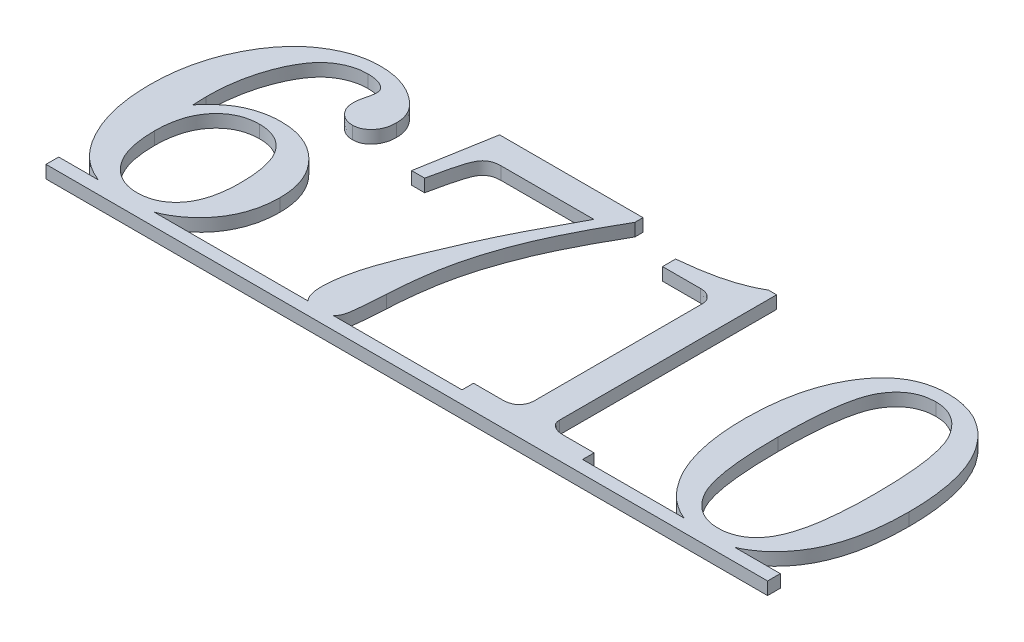
from build123d import *

# Parameters (mm, degrees)
BOSS_EXTRUDE2_DEPTH   = 5
BOSS_EXTRUDE2_2_DEPTH = 5
BOSS_EXTRUDE2_3_DEPTH = 5
BOSS_EXTRUDE2_4_DEPTH = 5
SKETCH6_W             = 283.8598671
SKETCH6_H             = 5
EXTRUDE_THIN9_DEPTH   = 5


with BuildPart() as part:
    # Sketch2 → Boss-Extrude2 (new body)
    with BuildSketch(Plane(origin=(0, 0, 0), x_dir=(1, 0, 0), z_dir=(0, 1, 0))):
        with BuildLine():
            add(Edge.make_bspline(
                [(-100.273944562, 11.315591843), (-99.432422661, 12.296005541), (-97.80531775, 14.191661424), (-95.124150317, 16.632446976), (-92.410660251, 18.678343856), (-89.586741579, 20.255885879), (-86.66536121, 21.455130526), (-83.616869513, 22.287043947), (-80.435400554, 22.837296348), (-78.261064732, 22.888267077), (-77.156957382, 22.914149536)],
                knots=[0, 0, 0, 0, 1.15518856, 2.233587714, 3.237434965, 4.189814948, 5.119660525, 6.056163246, 7.012937916, 8, 8, 8, 8], degree=3))
            add(Edge.make_bspline(
                [(-77.156957382, 22.914149536), (-76.267872032, 22.88979057), (-74.516489022, 22.841806561), (-71.94485009, 22.500634422), (-69.491077891, 21.915587863), (-67.145068853, 21.113058273), (-64.909427532, 20.063895456), (-62.784316633, 18.777349249), (-60.771731685, 17.266813831), (-58.897132382, 15.545958714), (-57.177159253, 13.655514974), (-55.676321774, 11.612805388), (-54.398324958, 9.446209735), (-53.357216887, 7.16351283), (-52.551214736, 4.75203121), (-51.970139378, 2.223901106), (-51.627369058, -0.433830019), (-51.580079845, -2.245110958), (-51.555995844, -3.167581233)],
                knots=[0, 0, 0, 0, 1.044483906, 2.057498042, 3.041291563, 4.003930521, 4.965577941, 5.937000168, 6.91766058, 7.91718785, 8.922517361, 9.915774843, 10.889917702, 11.872928882, 12.857847881, 13.872197807, 14.916328091, 16, 16, 16, 16], degree=3))
            add(Edge.make_bspline(
                [(-51.555995844, -3.167581233), (-51.581911796, -4.277388433), (-51.632844197, -6.458483113), (-52.064682487, -9.658046806), (-52.763484524, -12.717407155), (-53.741106198, -15.634942055), (-55.02601744, -18.395059066), (-56.537373496, -21.038920532), (-58.384625631, -23.508995506), (-60.471634529, -25.815031514), (-62.760543423, -27.906607194), (-65.202901, -29.742899087), (-67.76860182, -31.321824534), (-70.490062414, -32.580382215), (-73.334022253, -33.572853122), (-76.315128869, -34.268944993), (-79.427938671, -34.700620945), (-81.54923928, -34.752056727), (-82.625707382, -34.778158157)],
                knots=[0, 0, 0, 0, 1.07530773, 2.113293164, 3.12278084, 4.113357206, 5.089279015, 6.06946209, 7.059700115, 8.072336363, 9.080183726, 10.060046246, 11.030156511, 11.994333323, 12.960419743, 13.944696705, 14.957022674, 16, 16, 16, 16], degree=3))
            add(Edge.make_bspline(
                [(-82.625707382, -34.778158157), (-83.387383318, -34.761014278), (-84.900510493, -34.72695666), (-87.13781002, -34.508364454), (-89.314156186, -34.12631249), (-91.424542881, -33.585335042), (-93.464719495, -32.882045184), (-95.448070736, -32.034447532), (-97.360972645, -31.033369296), (-99.222768123, -29.893982317), (-100.983959191, -28.554896899), (-102.688465866, -27.08076911), (-104.308040499, -25.422683644), (-105.811585824, -23.5763933), (-107.27439168, -21.581836531), (-108.627629559, -19.402412836), (-109.880875821, -17.042765096), (-111.09498075, -14.549636194), (-112.161562949, -11.896159256), (-113.110296174, -9.131198402), (-113.889362692, -6.251771742), (-114.522912574, -3.260405275), (-115.050026571, -0.168271005), (-115.410142871, 3.035069393), (-115.603500406, 6.345226369), (-115.639998998, 8.590997895), (-115.658559947, 9.733059792)],
                knots=[0, 0, 0, 0, 0.883664919, 1.755467568, 2.604957291, 3.444820255, 4.280205446, 5.10616279, 5.944667041, 6.78306393, 7.635198672, 8.508239482, 9.395699299, 10.320121956, 11.268418048, 12.263647801, 13.293052967, 14.36716297, 15.479155568, 16.608498161, 17.756732724, 18.93730736, 20.154818251, 21.394408002, 22.674955442, 24, 24, 24, 24], degree=3))
            add(Edge.make_bspline(
                [(-115.658559947, 9.733059792), (-115.647179984, 10.969001941), (-115.624635465, 13.417491586), (-115.32336708, 17.039622971), (-114.893683469, 20.57820621), (-114.269540559, 24.028754143), (-113.472607747, 27.394208421), (-112.485315277, 30.670346299), (-111.328597864, 33.857118506), (-109.981202315, 36.933287823), (-108.514879859, 39.877865822), (-106.928102491, 42.652829192), (-105.246632956, 45.232298411), (-103.488621414, 47.638630235), (-101.59226576, 49.815008326), (-99.628696952, 51.840332012), (-97.546215765, 53.65463932), (-95.381427206, 55.289336991), (-93.139583941, 56.690997842), (-90.886849275, 57.95051259), (-88.600827749, 59.018401927), (-86.28109684, 59.877279946), (-83.942173786, 60.540131386), (-81.58740587, 61.029915597), (-79.200451619, 61.312204839), (-77.598368357, 61.354510286), (-76.796380459, 61.375687997)],
                knots=[0, 0, 0, 0, 1.243152028, 2.46277293, 3.654372621, 4.828515876, 5.988718833, 7.132190138, 8.269229334, 9.397502021, 10.509151182, 11.577424797, 12.611608541, 13.605920474, 14.572893715, 15.513533556, 16.441930275, 17.348883295, 18.239769449, 19.09980024, 19.944394787, 20.775522359, 21.585751549, 22.388144142, 23.193120032, 24, 24, 24, 24], degree=3))
            add(Edge.make_bspline(
                [(-76.796380459, 61.375687997), (-75.980910807, 61.363011708), (-74.379002327, 61.338110408), (-72.023525929, 61.060948803), (-69.761985135, 60.655956231), (-67.597329951, 60.04702983), (-65.530586636, 59.259695616), (-63.549536097, 58.324502515), (-61.660486275, 57.216747669), (-60.495879934, 56.345643317), (-59.909361229, 55.906937997)],
                knots=[0, 0, 0, 0, 1.081133678, 2.12377886, 3.141755168, 4.125997766, 5.101473931, 6.072112995, 7.02907811, 8, 8, 8, 8], degree=3))
            add(Edge.make_bspline(
                [(-59.909361229, 55.906937997), (-59.445822022, 55.536830297), (-58.546323735, 54.818635939), (-57.387346899, 53.594705215), (-56.369982236, 52.355217303), (-55.535633368, 51.04918989), (-54.919194606, 49.666340409), (-54.442474581, 48.241222486), (-54.188316242, 46.747854859), (-54.142940763, 45.73814842), (-54.120098408, 45.229854664)],
                knots=[0, 0, 0, 0, 1.127905394, 2.18870153, 3.201176125, 4.178074235, 5.128053522, 6.076756242, 7.031824741, 8, 8, 8, 8], degree=3))
            add(Edge.make_bspline(
                [(-54.120098408, 45.229854664), (-54.142824149, 44.565945864), (-54.186764976, 43.282260479), (-54.644768952, 41.452371578), (-55.364020914, 39.802986613), (-56.369797511, 38.37561475), (-57.586128313, 37.216152865), (-58.948296202, 36.34829053), (-60.459056542, 35.815330816), (-61.514319769, 35.761917605), (-62.052790716, 35.734662356)],
                knots=[0, 0, 0, 0, 1.153726211, 2.230760421, 3.261177434, 4.270660677, 5.249146575, 6.168386457, 7.065379467, 8, 8, 8, 8], degree=3))
            add(Edge.make_bspline(
                [(-62.052790716, 35.734662356), (-62.550295782, 35.760066844), (-63.530544466, 35.810122043), (-64.931323191, 36.254618957), (-66.232310028, 36.941782542), (-67.354721383, 37.935419037), (-68.304158009, 39.088777332), (-69.012840859, 40.382864469), (-69.42043589, 41.786740702), (-69.476428987, 42.756705646), (-69.504713793, 43.246681587)],
                knots=[0, 0, 0, 0, 1.014689736, 1.999272662, 2.976541523, 4.002645451, 5.040935778, 6.018204639, 6.998899853, 8, 8, 8, 8], degree=3))
            add(Edge.make_bspline(
                [(-69.504713793, 43.246681587), (-69.47341311, 43.97759597), (-69.406727088, 45.534807133), (-69.038857356, 47.050034368), (-68.8436561, 47.854053382)],
                knots=[0, 0, 0, 0, 0.938747937, 2, 2, 2, 2], degree=3))
            add(Edge.make_bspline(
                [(-68.8436561, 47.854053382), (-68.7435007, 48.226569142), (-68.555196608, 48.926943182), (-68.390626887, 49.928525358), (-68.249847494, 50.794970816), (-68.23123359, 51.332500512), (-68.222662511, 51.58001492)],
                knots=[0, 0, 0, 0, 1.221676289, 2.296897074, 3.215778188, 4, 4, 4, 4], degree=3))
            add(Edge.make_bspline(
                [(-68.222662511, 51.58001492), (-68.237638927, 51.884335062), (-68.267296629, 52.486978302), (-68.637135671, 53.324241608), (-69.200899696, 54.085176225), (-69.713136777, 54.476776701), (-69.985483023, 54.684982869)],
                knots=[0, 0, 0, 0, 0.975009045, 1.930804205, 2.899849836, 4, 4, 4, 4], degree=3))
            add(Edge.make_bspline(
                [(-69.985483023, 54.684982869), (-70.40583362, 54.926837355), (-71.284736984, 55.43252647), (-72.819950661, 55.924795607), (-74.569981551, 56.189832023), (-75.807160824, 56.227652782), (-76.455835588, 56.247482869)],
                knots=[0, 0, 0, 0, 0.860759205, 1.799745656, 2.846368109, 4, 4, 4, 4], degree=3))
            add(Edge.make_bspline(
                [(-76.455835588, 56.247482869), (-77.496186092, 56.20700235), (-79.552584226, 56.126986947), (-82.545394395, 55.309203587), (-85.411159452, 54.067077399), (-87.634156016, 52.584839636), (-89.337252275, 51.164861432), (-90.565804054, 49.883718912), (-91.737641424, 48.424397637), (-92.864147756, 46.787822176), (-93.942603216, 44.978756013), (-94.991402152, 42.991619794), (-95.959459631, 40.811257772), (-97.198991833, 37.657408189), (-98.533228185, 33.449477988), (-99.661381707, 28.109996093), (-100.360896227, 22.465349496), (-100.435864077, 18.602674532), (-100.474265075, 16.624085433)],
                knots=[0, 0, 0, 0, 0.971688549, 1.920678183, 2.88340009, 3.885392209, 4.408774106, 4.956875509, 5.543534456, 6.159017994, 6.815026857, 7.513966368, 8.260917618, 9.046686804, 10.685410247, 12.385720898, 14.148647427, 16, 16, 16, 16], degree=3))
            add(Edge.make_bspline(
                [(-100.474265075, 16.624085433), (-100.468535824, 16.290193862), (-100.45592903, 15.555490028), (-100.412276355, 14.340239463), (-100.352876597, 12.904555587), (-100.301473717, 11.86977531), (-100.273944562, 11.315591843)],
                knots=[0, 0, 0, 0, 0.754292582, 1.659765325, 2.74667174, 4, 4, 4, 4], degree=3))
        make_face()
        with BuildLine():
            add(Edge.make_bspline(
                [(-80.622502254, 17.785944408), (-81.27799847, 17.766159425), (-82.568345323, 17.727212609), (-84.460007656, 17.435375371), (-86.267552857, 16.990364456), (-87.976546921, 16.308371923), (-89.594489697, 15.45680379), (-91.110263838, 14.394633655), (-92.544378391, 13.164698008), (-93.8762984, 11.750335244), (-95.087365436, 10.16419231), (-96.120011034, 8.406836623), (-97.038169757, 6.520033702), (-97.750235575, 4.459081774), (-98.308710495, 2.253687877), (-98.705808633, -0.104318179), (-98.94931411, -2.614889769), (-98.977428988, -4.342220687), (-98.99189328, -5.230882516)],
                knots=[0, 0, 0, 0, 0.949075543, 1.868258902, 2.766701683, 3.639584075, 4.526552555, 5.40923933, 6.314579547, 7.258763553, 8.218230028, 9.198529645, 10.206493817, 11.252665883, 12.350497027, 13.498519192, 14.713060431, 16, 16, 16, 16], degree=3))
            add(Edge.make_bspline(
                [(-98.99189328, -5.230882516), (-98.978022258, -6.193024517), (-98.951100913, -8.060381954), (-98.700708284, -10.768874427), (-98.330668682, -13.307761293), (-97.793433903, -15.673886501), (-97.096552135, -17.868795976), (-96.231697112, -19.878542984), (-95.227016882, -21.722270503), (-94.070460123, -23.381162216), (-92.778347885, -24.850012597), (-91.398974654, -26.136650789), (-89.928706372, -27.228237092), (-88.375787973, -28.116506805), (-86.735952786, -28.809775243), (-85.003000264, -29.278842566), (-83.191482556, -29.596481841), (-81.952684427, -29.631944916), (-81.323624049, -29.649953028)],
                knots=[0, 0, 0, 0, 1.364103527, 2.647497837, 3.854117083, 5.000370457, 6.084428247, 7.115189779, 8.098401111, 9.057233799, 9.976535432, 10.867705672, 11.727535847, 12.567318146, 13.399161598, 14.244637041, 15.108628548, 16, 16, 16, 16], degree=3))
            add(Edge.make_bspline(
                [(-81.323624049, -29.649953028), (-80.701506905, -29.6302967), (-79.484176345, -29.59183409), (-77.704164152, -29.301901709), (-76.016819415, -28.844171103), (-74.415625636, -28.204499302), (-72.925176557, -27.345846993), (-71.516168782, -26.324080066), (-70.208306598, -25.110996604), (-68.998922513, -23.715058813), (-67.894513289, -22.139582809), (-66.956262824, -20.35741185), (-66.15613723, -18.404417686), (-65.492799116, -16.274380048), (-64.999821594, -13.952964353), (-64.647204273, -11.456220825), (-64.422363155, -8.773926806), (-64.39214329, -6.92739484), (-64.376508665, -5.972068413)],
                knots=[0, 0, 0, 0, 0.909396033, 1.779464838, 2.629860702, 3.462124791, 4.29295567, 5.138629575, 6.002374521, 6.895212095, 7.835129073, 8.809266767, 9.833779316, 10.917798107, 12.066925648, 13.300059089, 14.603151772, 16, 16, 16, 16], degree=3))
            add(Edge.make_bspline(
                [(-64.376508665, -5.972068413), (-64.385540297, -4.963416826), (-64.402965306, -3.017393951), (-64.606343064, -0.201792846), (-64.936909978, 2.402289391), (-65.415892418, 4.784665673), (-66.011865244, 6.952629899), (-66.752475235, 8.906309375), (-67.622553377, 10.652145325), (-68.642921787, 12.177480326), (-69.767924836, 13.512995118), (-71.016604516, 14.659698576), (-72.364157636, 15.624529245), (-73.81418152, 16.424087496), (-75.370363376, 17.037479628), (-77.029929422, 17.480777533), (-78.790843122, 17.747982523), (-80.000545897, 17.773054108), (-80.622502254, 17.785944408)],
                knots=[0, 0, 0, 0, 1.481997958, 2.859264748, 4.145766163, 5.336979382, 6.427417082, 7.446135251, 8.402802757, 9.287300334, 10.136644771, 10.963063103, 11.771815852, 12.566698608, 13.39031591, 14.223406735, 15.086582672, 16, 16, 16, 16], degree=3))
        make_face(mode=Mode.SUBTRACT)
    extrude(amount=BOSS_EXTRUDE2_DEPTH)



with BuildPart() as body_2:
    # Sketch2 → Boss-Extrude2 2 (new body)
    with BuildSketch(Plane(origin=(0, 0, 0), x_dir=(1, 0, 0), z_dir=(0, 1, 0))):
        with BuildLine():
            add(Edge.make_bspline(
                [(-29.761124049, 61.375687997), (-27.457438152, 61.375687997), (-22.676455246, 61.375687997), (-17.89547234, 61.375687997), (-15.418175331, 61.375687997)],
                knots=[0, 0, 0, 0, 0.963687151, 2, 2, 2, 2], degree=3))
            Line((-15.418175331, 61.375687997), (26.649132361, 61.375687997))
            Line((26.649132361, 61.375687997), (26.649132361, 58.250687997))
            add(Edge.make_bspline(
                [(26.649132361, 58.250687997), (25.886660046, 56.909267673), (24.398921171, 54.291883246), (22.23983503, 50.444290657), (20.266921022, 46.735441019), (18.41586243, 43.196969304), (16.735728179, 39.806274651), (15.191925286, 36.581368302), (13.783084922, 33.521663063), (12.14351043, 29.679761299), (10.340591707, 25.030686654), (8.39830409, 19.568814331), (6.778487297, 14.211569744), (5.405551978, 8.895282778), (4.276351676, 3.422692622), (3.424722816, -2.392237692), (2.703087808, -8.623619412), (2.43060043, -12.928152908), (2.290158002, -15.1467479)],
                knots=[0, 0, 0, 0, 0.94717065, 1.848122966, 2.708174387, 3.525835124, 4.29940308, 5.030920245, 5.720575528, 6.36697198, 7.594748366, 8.780924677, 9.924590417, 11.02909627, 12.150502086, 13.352793951, 14.635606369, 16, 16, 16, 16], degree=3))
            add(Edge.make_bspline(
                [(2.290158002, -15.1467479), (2.238092303, -16.04827447), (2.139340328, -17.75818198), (1.978126428, -20.188726908), (1.821079921, -22.345885249), (1.659198682, -24.235461716), (1.507674127, -25.852711121), (1.334732581, -27.199064906), (1.21796168, -28.280322776), (1.000527813, -29.332126142), (0.710587782, -30.41922922), (0.188168334, -31.554142985), (-0.500875898, -32.536157673), (-1.356971645, -33.345715724), (-2.346846215, -33.991275918), (-3.476556563, -34.468505707), (-4.750759719, -34.713631475), (-5.641638392, -34.756134206), (-6.103271485, -34.778158157)],
                knots=[0, 0, 0, 0, 1.80468871, 3.422917174, 4.868088381, 6.127020532, 7.213196683, 8.113639518, 8.840280135, 9.384637349, 10.258992284, 11.082909861, 11.867865964, 12.641855903, 13.422831762, 14.218379112, 15.076804522, 16, 16, 16, 16], degree=3))
            add(Edge.make_bspline(
                [(-6.103271485, -34.778158157), (-6.628066452, -34.756833363), (-7.631798677, -34.716047183), (-9.040637894, -34.246974844), (-10.277950527, -33.515847727), (-11.321758378, -32.465163603), (-12.136403788, -31.090707854), (-12.706591745, -29.39393306), (-13.031177534, -27.371902451), (-13.072433746, -25.918568737), (-13.094457382, -25.14274149)],
                knots=[0, 0, 0, 0, 0.928757684, 1.77635853, 2.606183773, 3.461548056, 4.376805525, 5.419496668, 6.622460364, 8, 8, 8, 8], degree=3))
            add(Edge.make_bspline(
                [(-13.094457382, -25.14274149), (-13.070933386, -24.360895951), (-13.02074498, -22.692829811), (-12.727127065, -20.056438577), (-12.232671575, -17.144269575), (-11.687025912, -14.524368057), (-11.073453599, -12.224487157), (-10.522957963, -10.240460564), (-9.815636192, -8.057407542), (-8.964464134, -5.681349354), (-8.023214346, -3.087894455), (-6.966693602, -0.28511578), (-5.758994985, 2.715159646), (-4.9032497, 4.779255425), (-4.46064328, 5.846841843)],
                knots=[0, 0, 0, 0, 0.869844758, 1.855812328, 2.947495476, 4.155214101, 4.830816511, 5.595013126, 6.445357338, 7.38270219, 8.402503007, 9.514416285, 10.714412654, 12, 12, 12, 12], degree=3))
            add(Edge.make_bspline(
                [(-4.46064328, 5.846841843), (-3.863032529, 7.290559494), (-2.701375758, 10.096908579), (-0.949014295, 14.172908467), (0.732916732, 18.019487942), (2.345123616, 21.636864013), (3.910595757, 25.007997265), (5.417696832, 28.137656342), (6.849782144, 31.041228862), (7.815541334, 32.885201094), (8.279741335, 33.771521331)],
                knots=[0, 0, 0, 0, 1.221319864, 2.374044455, 3.467861606, 4.502840189, 5.469583696, 6.373007887, 7.217973021, 8, 8, 8, 8], degree=3))
            Line((8.279741335, 33.771521331), (17.57461313, 51.119277741))
            Line((17.57461313, 51.119277741), (-18.963848408, 51.119277741))
            add(Edge.make_bspline(
                [(-18.963848408, 51.119277741), (-19.601574742, 51.085846634), (-20.805819626, 51.0227173), (-22.509897112, 50.514490332), (-23.929976871, 49.611916059), (-24.93513294, 48.56237042), (-25.578387385, 47.404804414), (-26.112433523, 46.198435074), (-26.663833585, 44.649016389), (-27.238916598, 42.762728873), (-27.839998919, 40.531215634), (-28.444719387, 37.954429844), (-29.118899282, 35.040553546), (-29.539138712, 32.978014575), (-29.761124049, 31.88850851)],
                knots=[0, 0, 0, 0, 0.951352685, 1.79647843, 2.620766002, 3.439002343, 3.934883463, 4.590834643, 5.40767286, 6.388399779, 7.534730358, 8.857422379, 10.339979304, 12, 12, 12, 12], degree=3))
            Line((-29.761124049, 31.88850851), (-34.889329177, 31.88850851))
            Line((-34.889329177, 31.88850851), (-29.761124049, 61.375687997))
        make_face()
    extrude(amount=BOSS_EXTRUDE2_2_DEPTH)


with BuildPart() as body_3:
    # Sketch2 → Boss-Extrude2 3 (new body)
    with BuildSketch(Plane(origin=(0, 0, 0), x_dir=(1, 0, 0), z_dir=(0, 1, 0))):
        with BuildLine():
            Line((79.213234925, 61.375687997), (79.213234925, -23.980882516))
            add(Edge.make_bspline(
                [(79.213234925, -23.980882516), (79.226633261, -24.283562413), (79.252416785, -24.866034325), (79.50388558, -25.674077553), (79.87919147, -26.39884989), (80.275474653, -26.749047711), (80.475254156, -26.925594054)],
                knots=[0, 0, 0, 0, 1.091998458, 2.101422775, 3.042864219, 4, 4, 4, 4], degree=3))
            add(Edge.make_bspline(
                [(80.475254156, -26.925594054), (80.789355803, -27.143292708), (81.421051082, -27.581110253), (82.50354076, -28.051000998), (83.695677067, -28.302052694), (84.520636062, -28.345625085), (84.942401592, -28.367901746)],
                knots=[0, 0, 0, 0, 0.958209587, 1.927071949, 2.940202358, 4, 4, 4, 4], degree=3))
            Line((84.942401592, -28.367901746), (97.161952874, -28.367901746))
            Line((97.161952874, -28.367901746), (97.161952874, -33.496106874))
            Line((97.161952874, -33.496106874), (49.726055438, -33.496106874))
            Line((49.726055438, -33.496106874), (49.726055438, -28.367901746))
            Line((49.726055438, -28.367901746), (60.8438439, -28.367901746))
            add(Edge.make_bspline(
                [(60.8438439, -28.367901746), (61.386519553, -28.352941557), (62.409355152, -28.324744577), (63.838594947, -28.00490379), (65.048044064, -27.468865446), (66.027051236, -26.699489578), (66.766110308, -25.749533447), (67.300582317, -24.651175951), (67.628690126, -23.412078434), (67.659017924, -22.53400286), (67.674773387, -22.077837644)],
                knots=[0, 0, 0, 0, 1.230173287, 2.318631808, 3.302181885, 4.2089069, 5.115631914, 6.010495468, 6.966441169, 8, 8, 8, 8], degree=3))
            Line((67.674773387, -22.077837644), (67.674773387, 43.747482869))
            add(Edge.make_bspline(
                [(67.674773387, 43.747482869), (67.655390019, 44.076765044), (67.617835709, 44.714732857), (67.324335392, 45.638322469), (66.814731967, 46.462236327), (66.118537431, 47.178295487), (65.309491394, 47.810382528), (64.349116832, 48.248250366), (63.28270803, 48.51993822), (62.534975323, 48.543115797), (62.145927233, 48.555175177)],
                knots=[0, 0, 0, 0, 0.965775298, 1.871141535, 2.812728301, 3.783665025, 4.791517812, 5.809051675, 6.860041491, 8, 8, 8, 8], degree=3))
            Line((62.145927233, 48.555175177), (47.161952874, 48.555175177))
            Line((47.161952874, 48.555175177), (47.161952874, 53.683380305))
            add(Edge.make_bspline(
                [(47.161952874, 53.683380305), (48.846032724, 53.865586019), (52.060551673, 54.213374588), (56.619312783, 54.887070779), (60.676152392, 55.664155635), (64.282633823, 56.529039139), (67.544748428, 57.516321186), (70.550076998, 58.675629964), (73.386111041, 59.908086976), (75.147296375, 60.893869453), (76.00810672, 61.375687997)],
                knots=[0, 0, 0, 0, 1.35111768, 2.57897117, 3.674778643, 4.644977761, 5.536274967, 6.390979402, 7.213562849, 8, 8, 8, 8], degree=3))
            Line((76.00810672, 61.375687997), (79.213234925, 61.375687997))
        make_face()
    extrude(amount=BOSS_EXTRUDE2_3_DEPTH)


with BuildPart() as body_4:
    # Sketch2 → Boss-Extrude2 4 (new body)
    with BuildSketch(Plane(origin=(0, 0, 0), x_dir=(1, 0, 0), z_dir=(0, 1, 0))):
        with BuildLine():
            add(Edge.make_bspline(
                [(146.661151592, 61.375687997), (147.731544448, 61.346929529), (149.830123757, 61.29054656), (152.903975787, 60.785841517), (155.848146437, 60.009130635), (158.668936253, 58.913127678), (161.327389786, 57.442143684), (163.857975927, 55.692836669), (166.275769305, 53.643566283), (167.705963648, 52.051912839), (168.435991335, 51.239470049)],
                knots=[0, 0, 0, 0, 1.034177873, 2.027577328, 3.003134204, 3.974152387, 4.944805699, 5.933263622, 6.945056114, 8, 8, 8, 8], degree=3))
            add(Edge.make_bspline(
                [(168.435991335, 51.239470049), (169.306424896, 50.151399512), (171.077288044, 47.93776242), (173.23844345, 44.156315102), (175.1102994, 40.013857679), (176.630485471, 35.46306359), (177.774482662, 30.509483435), (178.604062428, 25.160193506), (179.139188765, 19.412716549), (179.188061381, 15.44343964), (179.213234925, 13.398925177)],
                knots=[0, 0, 0, 0, 0.831632311, 1.691923517, 2.593854152, 3.545333385, 4.553909998, 5.628531033, 6.778492226, 8, 8, 8, 8], degree=3))
            add(Edge.make_bspline(
                [(179.213234925, 13.398925177), (179.189199249, 11.495027572), (179.142492415, 7.795317655), (178.699916479, 2.42190639), (177.960808388, -2.602615097), (176.956716765, -7.282814648), (175.633582826, -11.604546887), (174.034106903, -15.581380004), (172.129369469, -19.211981544), (169.927089223, -22.469018419), (167.519087905, -25.35006799), (164.998345001, -27.876572923), (162.335872223, -29.999111519), (159.546565645, -31.740637141), (156.639195339, -33.113674182), (153.596875301, -34.088509156), (150.434932504, -34.654242005), (148.285957729, -34.736611211), (147.202016977, -34.778158157)],
                knots=[0, 0, 0, 0, 1.417208335, 2.753960989, 4.010288699, 5.195991505, 6.314016688, 7.371005355, 8.382792458, 9.360343293, 10.29216761, 11.174475273, 12.012952715, 12.821282545, 13.617429245, 14.400351687, 15.193138972, 16, 16, 16, 16], degree=3))
            add(Edge.make_bspline(
                [(147.202016977, -34.778158157), (146.158588931, -34.747837843), (144.10043706, -34.688031315), (141.072704944, -34.198540711), (138.187164114, -33.372338782), (135.422668724, -32.24639181), (132.815984768, -30.761951552), (130.311080745, -28.995173544), (127.953990326, -26.880727801), (126.545791551, -25.265266334), (125.827818259, -24.441619695)],
                knots=[0, 0, 0, 0, 1.018622209, 2.009222595, 2.98557584, 3.944681745, 4.91693228, 5.908476626, 6.933632133, 8, 8, 8, 8], degree=3))
            add(Edge.make_bspline(
                [(125.827818259, -24.441619695), (124.967530397, -23.310623463), (123.224479894, -21.019084039), (121.04328831, -17.188294328), (119.204841644, -13.009277462), (117.704231396, -8.465497717), (116.529004121, -3.574086597), (115.697248871, 1.683391936), (115.192123563, 7.292520411), (115.138317833, 11.154240176), (115.110670823, 13.13850851)],
                knots=[0, 0, 0, 0, 0.855190123, 1.732721847, 2.647494282, 3.601413261, 4.611082414, 5.674349109, 6.80501028, 8, 8, 8, 8], degree=3))
            add(Edge.make_bspline(
                [(115.110670823, 13.13850851), (115.139307895, 15.036008679), (115.195166464, 18.737212543), (115.690954119, 24.13576056), (116.458277592, 29.244922281), (117.550757924, 34.056956456), (118.977913881, 38.573510493), (120.714724291, 42.788266199), (122.77663928, 46.711172182), (124.415667132, 49.1104903), (125.22685672, 50.297963638)],
                knots=[0, 0, 0, 0, 1.162878212, 2.268273489, 3.320083559, 4.327872371, 5.289661935, 6.220038334, 7.119059284, 8, 8, 8, 8], degree=3))
            add(Edge.make_bspline(
                [(125.22685672, 50.297963638), (125.90681527, 51.184408031), (127.237047677, 52.91859765), (129.550579763, 55.15834643), (131.986879336, 57.094684775), (134.604868286, 58.667292104), (137.396100395, 59.876547697), (140.343137088, 60.737465721), (143.449978568, 61.273162165), (145.577242776, 61.341081125), (146.661151592, 61.375687997)],
                knots=[0, 0, 0, 0, 1.066527708, 2.08649442, 3.068328227, 4.035911514, 4.996311456, 5.967697152, 6.964477018, 8, 8, 8, 8], degree=3))
        make_face()
        with BuildLine():
            add(Edge.make_bspline(
                [(147.001696464, 56.247482869), (146.27245891, 56.217868751), (144.843939729, 56.159857015), (142.755291226, 55.782473968), (140.802915748, 55.104615857), (138.952097282, 54.211156784), (137.25910562, 52.994810945), (135.665602728, 51.553969373), (134.224383866, 49.823329498), (132.863231848, 47.824395328), (131.659117664, 45.394215481), (130.659414244, 42.435023708), (129.817324, 38.926350949), (129.135411591, 34.861739467), (128.57115859, 30.250785668), (128.219367344, 25.075278887), (127.969114468, 19.344229087), (127.944211327, 15.335678563), (127.931183643, 13.238668767)],
                knots=[0, 0, 0, 0, 0.667148774, 1.30689213, 1.932721232, 2.552800968, 3.179791468, 3.832667273, 4.513077547, 5.234758394, 6.04058107, 6.985198211, 8.085901752, 9.338111265, 10.75333435, 12.333478328, 14.081917187, 16, 16, 16, 16], degree=3))
            add(Edge.make_bspline(
                [(127.931183643, 13.238668767), (127.946072418, 11.188547227), (127.974600293, 7.260379193), (128.202083061, 1.63313836), (128.628708647, -3.456919725), (129.161373397, -8.0219995), (129.904686183, -12.04656165), (130.756395516, -15.554795046), (131.808256934, -18.527442847), (133.042459134, -21.007282028), (134.440322863, -23.056909234), (135.898902412, -24.828388505), (137.505694784, -26.30366135), (139.20482588, -27.537949806), (141.026270079, -28.492943379), (142.958517522, -29.156188189), (145.00100852, -29.569801879), (146.405423884, -29.622876778), (147.121888771, -29.649953028)],
                knots=[0, 0, 0, 0, 1.884102424, 3.610064464, 5.174084282, 6.577654309, 7.831839042, 8.933221405, 9.89214569, 10.723697405, 11.470879788, 12.167811872, 12.827890927, 13.469923399, 14.092994405, 14.710144424, 15.341977984, 16, 16, 16, 16], degree=3))
            add(Edge.make_bspline(
                [(147.121888771, -29.649953028), (147.838266274, -29.62990972), (149.24163236, -29.590645368), (151.280688579, -29.19248293), (153.196546706, -28.57722547), (154.986612133, -27.70407896), (156.637035968, -26.573777635), (158.147834221, -25.189270926), (159.551351474, -23.575730965), (160.338196695, -22.349287137), (160.743683643, -21.717260721)],
                knots=[0, 0, 0, 0, 1.037540769, 2.032517106, 2.999982528, 3.948219519, 4.909561987, 5.889684619, 6.91248581, 8, 8, 8, 8], degree=3))
            add(Edge.make_bspline(
                [(160.743683643, -21.717260721), (161.206050749, -20.859101695), (162.18918835, -19.034386235), (163.291176663, -15.902705225), (164.268917675, -12.31540033), (165.060975828, -8.237476722), (165.641743703, -3.672687067), (166.071389729, 1.373188905), (166.36335782, 6.911821194), (166.382659093, 10.767641227), (166.392722105, 12.777931587)],
                knots=[0, 0, 0, 0, 0.662021917, 1.407666401, 2.250371803, 3.189876895, 4.229599255, 5.378231133, 6.633100965, 8, 8, 8, 8], degree=3))
            add(Edge.make_bspline(
                [(166.392722105, 12.777931587), (166.381583803, 14.848290533), (166.360267433, 18.810522437), (166.084265258, 24.488200553), (165.71003064, 29.629672974), (165.140809874, 34.239374573), (164.377133876, 38.309926149), (163.511143568, 41.866563813), (162.435534615, 44.884939298), (161.180796608, 47.403726489), (159.764904197, 49.495365779), (158.276987189, 51.302734521), (156.679401934, 52.836886849), (154.949333126, 54.078894669), (153.113950791, 55.043981052), (151.17892193, 55.761170923), (149.12172114, 56.164807514), (147.717872325, 56.219553905), (147.001696464, 56.247482869)],
                knots=[0, 0, 0, 0, 1.880898734, 3.599644876, 5.163555013, 6.563973479, 7.81694835, 8.92495287, 9.886457661, 10.722129126, 11.474279202, 12.176496217, 12.845948905, 13.480688063, 14.104872593, 14.724796833, 15.349452935, 16, 16, 16, 16], degree=3))
        make_face(mode=Mode.SUBTRACT)
    extrude(amount=BOSS_EXTRUDE2_4_DEPTH)


with BuildPart() as part_1:
    add(part.part)

    add(body_2.part)  # Extrude-Thin9 merges body 2

    add(body_3.part)  # Extrude-Thin9 merges body 3

    add(body_4.part)  # Extrude-Thin9 merges body 4
    # Sketch6 → Extrude-Thin9 (add)
    with BuildSketch(Plane(origin=(0, 0, 0), x_dir=(1, 0, 0), z_dir=(0, 1, 0))):
        with Locations((32.998834083, -35.39135521)):
            Rectangle(SKETCH6_W, SKETCH6_H)
        Polygon((38.323120906, -36.783642894), (39.004189139, -32.89135521), (43.929359116, -33.753156054), (43.248290883, -37.645443738), align=None)
    extrude(amount=EXTRUDE_THIN9_DEPTH)


solid = part_1.part
